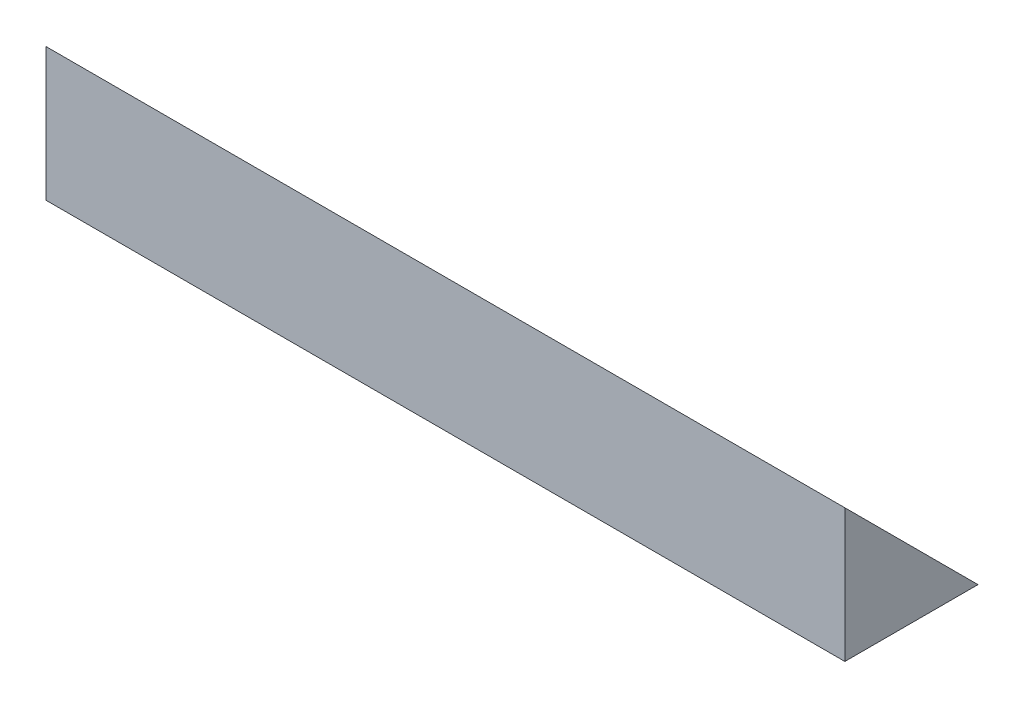
from build123d import *

# Parameters (mm, degrees)
EXTRUDE_1_DEPTH = 1200


with BuildPart() as part:
    # 草图1 → 凸台-拉伸1 (new body)
    with BuildSketch(Plane(origin=(0, 0, 0), x_dir=(0, 0, -1), z_dir=(1, 0, 0))):
        Polygon((0, 0), (0, -200), (200, -200), align=None)
    extrude(amount=EXTRUDE_1_DEPTH)


solid = part.part
